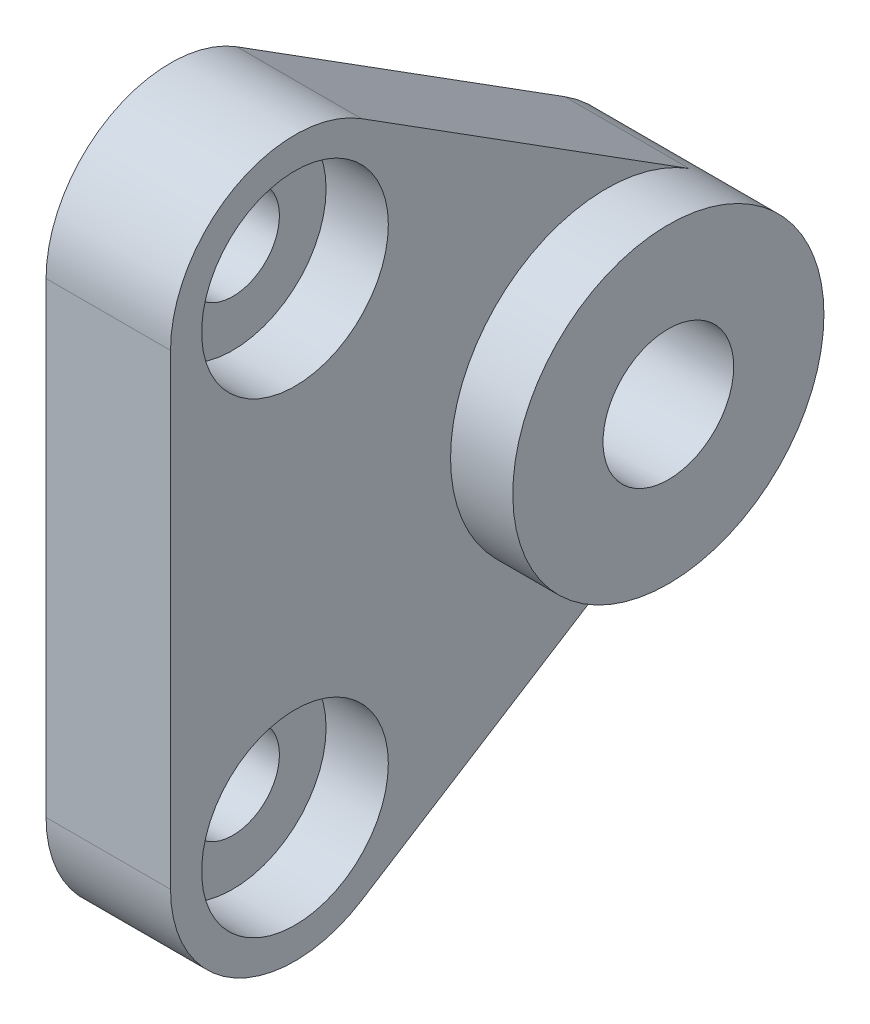
from build123d import *
from build123d.topology import SkipClean

# Parameters (mm, degrees)
SKETCH_1_R          = 1.5
SKETCH_1_R_2        = 2.1
EXTRUDE_1_DEPTH     = 6
SKETCH_2_R          = 3
CUT_EXTRUDE_1_DEPTH = 3
SKETCH_3_R          = 3
CUT_EXTRUDE_2_DEPTH = 1
CUT_EXTRUDE_START   = -2
SKETCH_4_R          = 3
CUT_EXTRUDE_3_DEPTH = 2


with BuildPart() as part:
    # 草图1 → 凸台-拉伸1 (new body)
    with BuildSketch(Plane(origin=(0, 0, 0), x_dir=(0, 0, -1), z_dir=(1, 0, 0))):
        with BuildLine():
            Line((-4, 15), (-4, 0))
            ThreePointArc((-4, 0), (-1.930643586, -3.503229274), (2.136307673, -3.381743563))
            Line((2.136307673, -3.381743563), (12.670384591, 3.272820546))
            ThreePointArc((12.670384591, 3.272820546), (15, 7.5), (12.670384591, 11.727179454))
            Line((12.670384591, 11.727179454), (2.136307673, 18.381743563))
            ThreePointArc((2.136307673, 18.381743563), (-1.930643586, 18.503229274), (-4, 15))
        make_face()
        Circle(SKETCH_1_R, mode=Mode.SUBTRACT)
        with Locations((0, 15)):
            Circle(SKETCH_1_R, mode=Mode.SUBTRACT)
        with Locations((10, 7.5)):
            Circle(SKETCH_1_R_2, mode=Mode.SUBTRACT)
    extrude(amount=EXTRUDE_1_DEPTH)

    # 草图2 → 切除-拉伸1 (cut)
    with BuildSketch(Plane(origin=(6, 0, 0), x_dir=(0, 0, -1), z_dir=(1, 0, 0))):
        with Locations((0, 15)):
            Circle(SKETCH_2_R)
        Circle(SKETCH_2_R)
    extrude(amount=-CUT_EXTRUDE_1_DEPTH, mode=Mode.SUBTRACT)

    # 草图3 → 切除-拉伸2 (cut)
    with BuildSketch(Plane(origin=(3, 0, 0), x_dir=(0, 0, -1), z_dir=(1, 0, 0))):
        Circle(SKETCH_3_R)
        with Locations((0, 15)):
            Circle(SKETCH_3_R)
    extrude(amount=-CUT_EXTRUDE_2_DEPTH, mode=Mode.SUBTRACT)

    # 草图4 → 切除-拉伸3 (cut)
    with SkipClean():  # the faces are left unmerged after this step: merging them gives an invalid solid
        with BuildSketch(Plane(origin=(6, 0, 0), x_dir=(0, 0, -1), z_dir=(1, 0, 0)).offset(CUT_EXTRUDE_START)):
            with BuildLine():
                ThreePointArc((12.670384591, 3.272820546), (5, 7.5), (12.670384591, 11.727179454))
                Line((12.670384591, 11.727179454), (2.136307673, 18.381743563))
                ThreePointArc((2.136307673, 18.381743563), (-1.930643586, 18.503229274), (-4, 15))
                Line((-4, 15), (-4, 0))
                ThreePointArc((-4, 0), (-1.930643586, -3.503229274), (2.136307673, -3.381743563))
                Line((2.136307673, -3.381743563), (12.670384591, 3.272820546))
            make_face()
            Circle(SKETCH_4_R, mode=Mode.SUBTRACT)
            with Locations((0, 15)):
                Circle(SKETCH_4_R, mode=Mode.SUBTRACT)
        extrude(amount=CUT_EXTRUDE_3_DEPTH, mode=Mode.SUBTRACT)


solid = part.part
